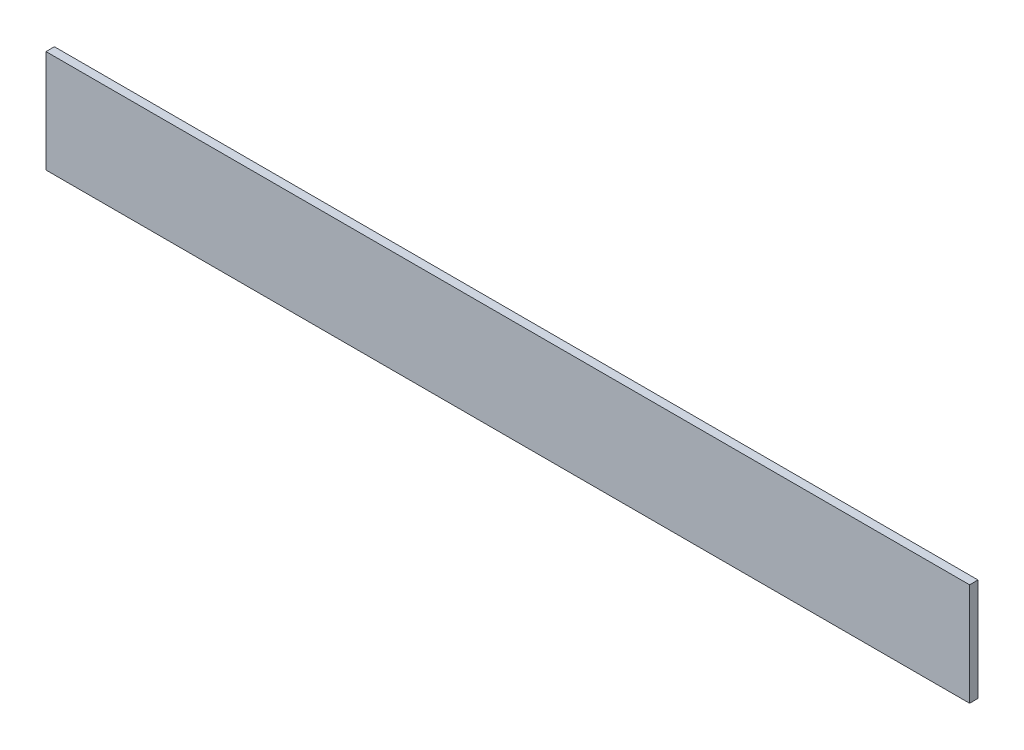
from build123d import *

# Parameters (mm, degrees)
SKETCH1_W           = 4500
SKETCH1_H           = 41
BOSS_EXTRUDE1_DEPTH = 500


with BuildPart() as part:
    # Sketch1 → Boss-Extrude1 (new body)
    with BuildSketch(Plane(origin=(0, 0, 0), x_dir=(1, 0, 0), z_dir=(0, 1, 0))):
        with Locations((2250, 20.5)):
            Rectangle(SKETCH1_W, SKETCH1_H)
    extrude(amount=BOSS_EXTRUDE1_DEPTH)


solid = part.part
